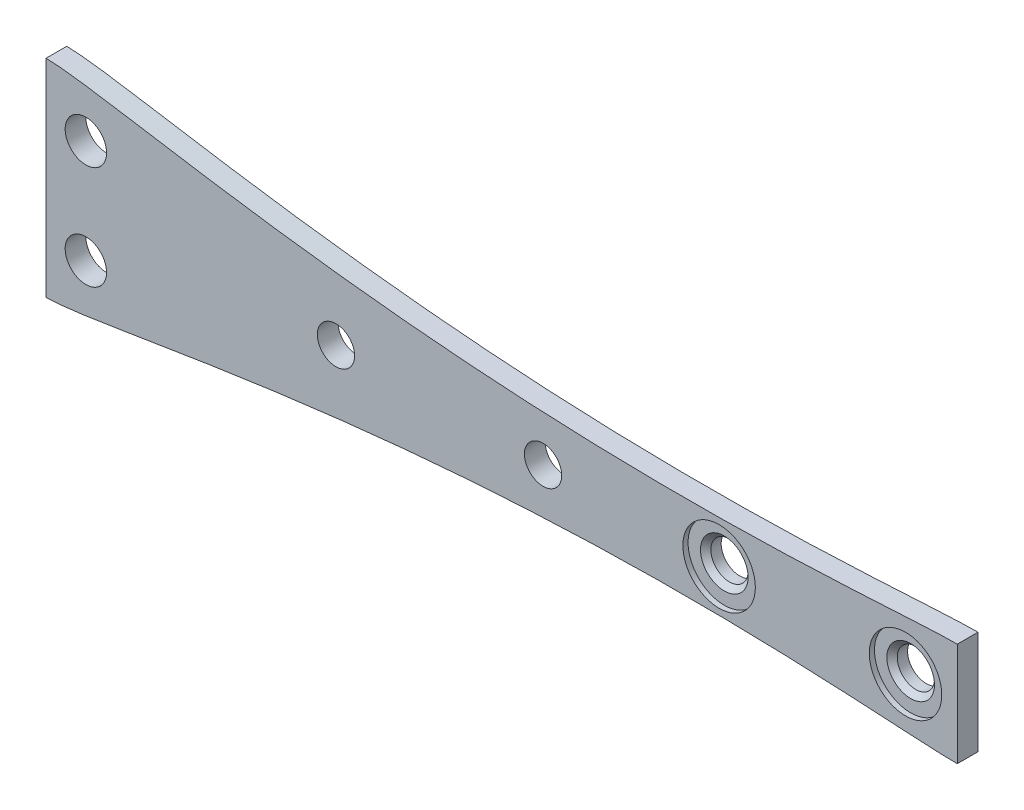
from build123d import *

# Parameters (mm, degrees)
ESQUISSE1_R             = 2
ESQUISSE1_R_2           = 1.8
BOSS_EXTRU_1_DEPTH      = 2
ESQUISSE3_R             = 3.5
ENL_V_MAT_EXTRU_1_DEPTH = 0.5
CHANFREIN1_SIZE         = 0.5


with BuildPart() as part:
    # Esquisse1 → Boss.-Extru.1 (new body)
    with BuildSketch(Plane.XY):
        with BuildLine():
            Line((0, 0), (0, 20))
            add(Edge.make_bspline(
                [(0, 20), (8, 20), (43, 10), (78, 15), (88, 15)],
                knots=[0, 0, 0, 0, 0, 1, 1, 1, 1, 1], degree=4))
            Line((88, 15), (88, 5))
            add(Edge.make_bspline(
                [(0, 0), (8, 0), (43, 10), (78, 5), (88, 5)],
                knots=[0, 0, 0, 0, 0, 1, 1, 1, 1, 1], degree=4))
        make_face()
        with Locations((3.85, 15)):
            Circle(ESQUISSE1_R, mode=Mode.SUBTRACT)
        with Locations((3.85, 5)):
            Circle(ESQUISSE1_R, mode=Mode.SUBTRACT)
        with Locations((65, 10)):
            Circle(ESQUISSE1_R_2, mode=Mode.SUBTRACT)
        with Locations((83, 10)):
            Circle(ESQUISSE1_R_2, mode=Mode.SUBTRACT)
        with Locations((28, 10)):
            Circle(ESQUISSE1_R_2, mode=Mode.SUBTRACT)
        with Locations((48, 10)):
            Circle(ESQUISSE1_R_2, mode=Mode.SUBTRACT)
    extrude(amount=BOSS_EXTRU_1_DEPTH)

    # Esquisse3 → Enlèv. mat.-Extru.1 (cut)
    with BuildSketch(Plane.XY.offset(2)):
        with Locations((65, 10)):
            Circle(ESQUISSE3_R)
        with Locations((83, 10)):
            Circle(ESQUISSE3_R)
    extrude(amount=-ENL_V_MAT_EXTRU_1_DEPTH, mode=Mode.SUBTRACT)

    # Chanfrein1
    chanfrein1_edges = [part.edges().sort_by_distance(p)[0] for p in [
        (63.2, 10, 1.5),
        (81.2, 10, 1.5),
    ]]
    chamfer(chanfrein1_edges, length=CHANFREIN1_SIZE)


solid = part.part
